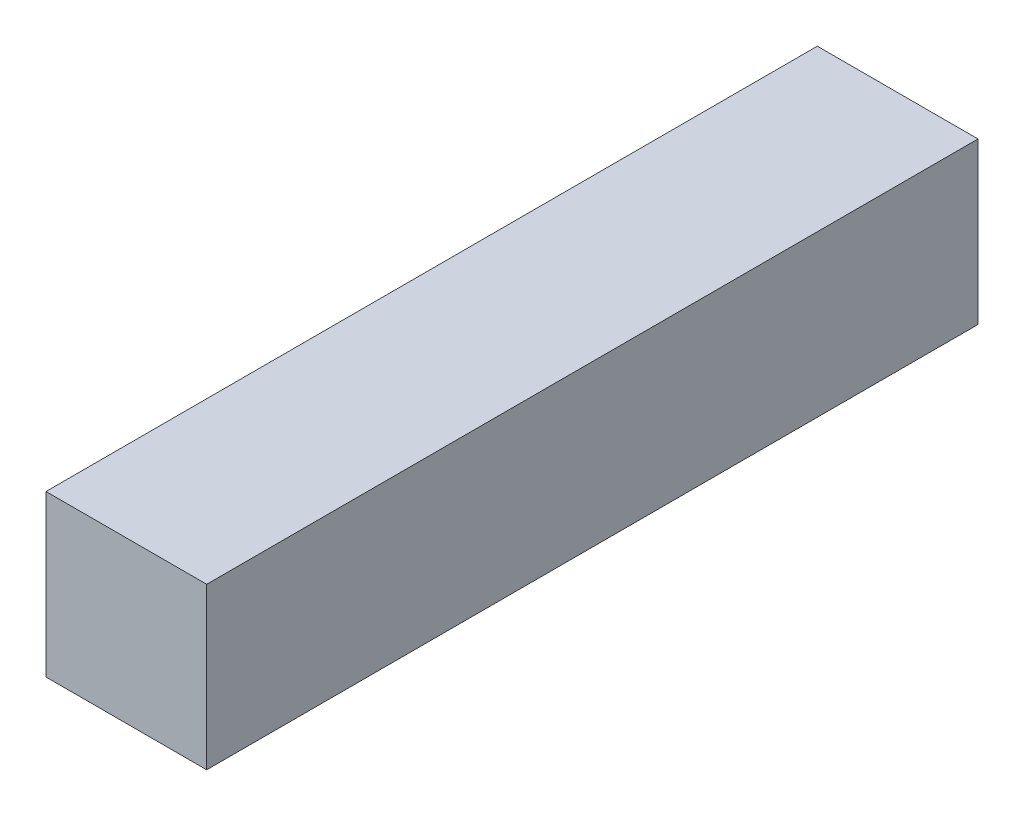
from build123d import *

# Parameters (mm, degrees)
SKETCH1_W           = 10
SKETCH1_H           = 10
BOSS_EXTRUDE1_DEPTH = 24


with BuildPart() as part:
    # Sketch1 → Boss-Extrude1 (new, symmetric)
    with BuildSketch(Plane.XY):
        Rectangle(SKETCH1_W, SKETCH1_H)
    extrude(amount=BOSS_EXTRUDE1_DEPTH, both=True)


solid = part.part
